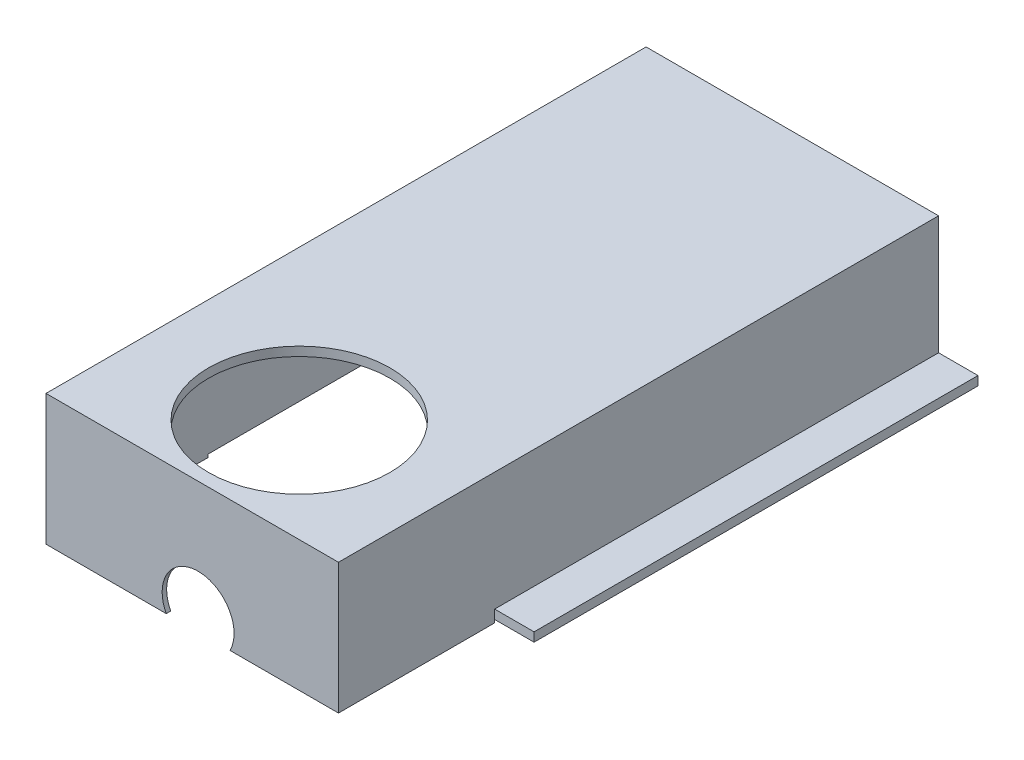
from build123d import *

# Parameters (mm, degrees)
SKETCH1_W           = 97.58
SKETCH1_H           = 200.21
BOSS_EXTRUDE1_DEPTH = 43.58
SKETCH2_W           = 2
SKETCH2_H           = 148.11
CUT_EXTRUDE1_DEPTH  = 1
SKETCH3_W           = 148.11
SKETCH3_H           = 1
CUT_EXTRUDE2_DEPTH  = 100
SKETCH4_W           = 93.58
SKETCH4_H           = 50.6
CUT_EXTRUDE4_DEPTH  = 40.58
SKETCH5_W           = 93.58
SKETCH5_H           = 148.11
CUT_EXTRUDE5_DEPTH  = 39.58
SKETCH6_R           = 12
CUT_EXTRUDE6_DEPTH  = 39.58
SKETCH7_R           = 30.26
CUT_EXTRUDE7_DEPTH  = 39.58
SKETCH10_W          = 148.11
SKETCH10_H          = 3
BOSS_EXTRUDE2_DEPTH = 13.15
SKETCH11_W          = 148.11
SKETCH11_H          = 3
BOSS_EXTRUDE3_DEPTH = 13.15


with BuildPart() as part:
    # Sketch1 → Boss-Extrude1 (new body)
    with BuildSketch(Plane(origin=(0, 0, 0), x_dir=(1, 0, 0), z_dir=(0, 1, 0))):
        with Locations((48.79, 100.105)):
            Rectangle(SKETCH1_W, SKETCH1_H)
    extrude(amount=BOSS_EXTRUDE1_DEPTH)

    # Sketch2 → Cut-Extrude1 (cut)
    with BuildSketch(Plane.XZ):
        with Locations((1, -126.155)):
            Rectangle(SKETCH2_W, SKETCH2_H)
    extrude(amount=-CUT_EXTRUDE1_DEPTH, mode=Mode.SUBTRACT)

    # Sketch3 → Cut-Extrude2 (cut)
    with BuildSketch(Plane.ZY.offset(-2)):
        with Locations((-126.155, 0.5)):
            Rectangle(SKETCH3_W, SKETCH3_H)
    extrude(amount=-CUT_EXTRUDE2_DEPTH, mode=Mode.SUBTRACT)

    # Sketch4 → Cut-Extrude4 (cut)
    with BuildSketch(Plane(origin=(0, 0, 0), x_dir=(-1, 0, 0), z_dir=(0, -1, 0))):
        with Locations((-48.79, 26.8)):
            Rectangle(SKETCH4_W, SKETCH4_H)
    extrude(amount=-CUT_EXTRUDE4_DEPTH, mode=Mode.SUBTRACT)

    # Sketch5 → Cut-Extrude5 (cut)
    with BuildSketch(Plane(origin=(0, 1, 0), x_dir=(-1, 0, 0), z_dir=(0, -1, 0))):
        with Locations((-48.79, 126.155)):
            Rectangle(SKETCH5_W, SKETCH5_H)
    extrude(amount=-CUT_EXTRUDE5_DEPTH, mode=Mode.SUBTRACT)

    # Sketch6 → Cut-Extrude6 (cut)
    with BuildSketch(Plane.XY):
        with Locations((50.746792762, 5.57)):
            Circle(SKETCH6_R)
    extrude(amount=-CUT_EXTRUDE6_DEPTH, mode=Mode.SUBTRACT)

    # Sketch7 → Cut-Extrude7 (cut)
    with BuildSketch(Plane(origin=(0, 43.58, 0), x_dir=(1, 0, 0), z_dir=(0, 1, 0))):
        with Locations(Location((49.98, 34.51, 0), (0, 0, 270))):
            Circle(SKETCH7_R)
    extrude(amount=-CUT_EXTRUDE7_DEPTH, mode=Mode.SUBTRACT)

    # Sketch10 → Boss-Extrude2 (add)
    with BuildSketch(Plane.ZY):
        with Locations((-126.155, 2.5)):
            Rectangle(SKETCH10_W, SKETCH10_H)
    extrude(amount=BOSS_EXTRUDE2_DEPTH)

    # Sketch11 → Boss-Extrude3 (add)
    with BuildSketch(Plane(origin=(97.58, 0, 0), x_dir=(0, 0, -1), z_dir=(1, 0, 0))):
        with Locations((126.155, 2.5)):
            Rectangle(SKETCH11_W, SKETCH11_H)
    extrude(amount=BOSS_EXTRUDE3_DEPTH)


solid = part.part
